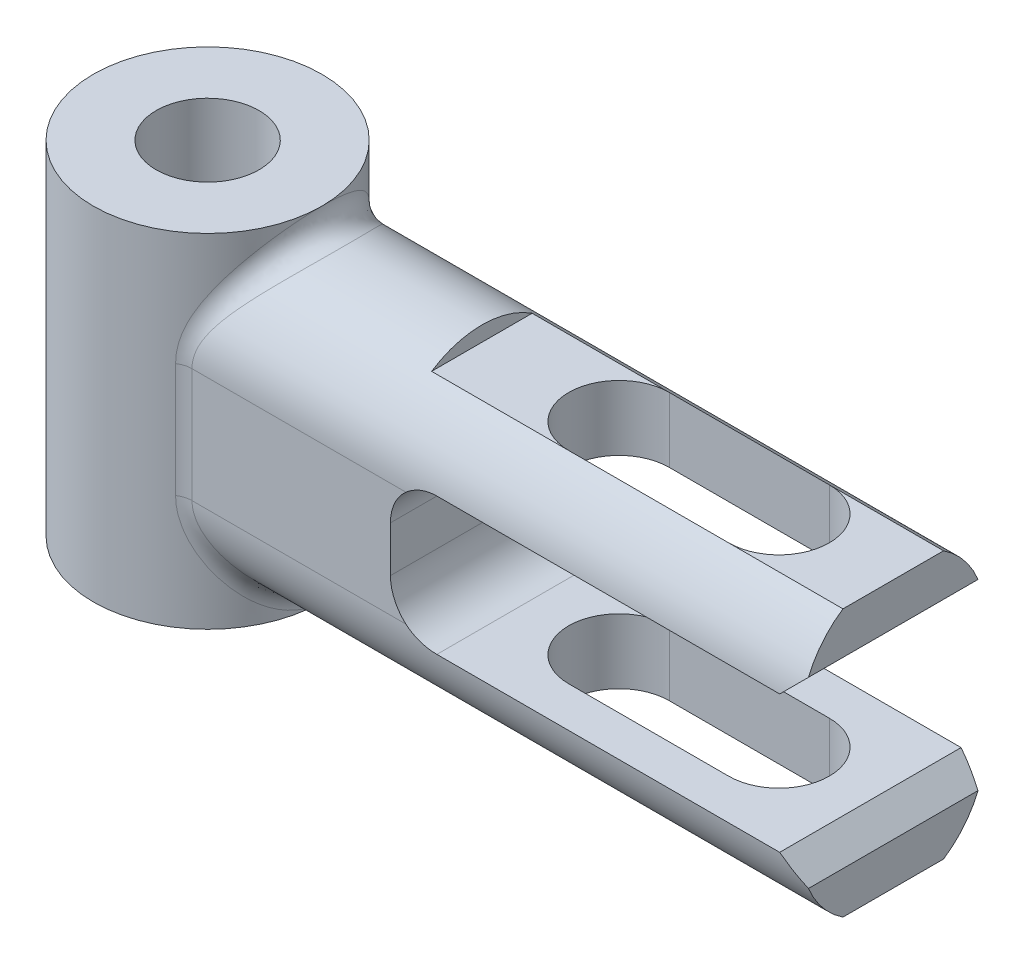
from build123d import *

# Parameters (mm, degrees)
SKETCH2_R            = 5
BOSS_EXTRUDE1_DEPTH  = 15
BOSS_EXTRUDE2_DEPTH  = 30
CUT_EXTRUDE1_DEPTH   = 34.911650063
M4_CLEARANCE_HOLE1_D = 4.5
FILLET1_R            = 1
SKETCH8_W            = 18
SKETCH8_H            = 6
SKETCH8_H_2          = 0.659341382
CUT_EXTRUDE2_DEPTH   = 35.727510864
CHAMFER1_SIZE        = 1
FILLET2_R            = 2


with BuildPart() as part:
    # Sketch2 → Boss-Extrude1 (new body)
    with BuildSketch(Plane(origin=(0, 0, 0), x_dir=(1, 0, 0), z_dir=(0, 1, 0))):
        with Locations(Location((0, 0, 0), (0, 0, 270))):
            Circle(SKETCH2_R)
    extrude(amount=BOSS_EXTRUDE1_DEPTH)

    # Sketch3 → Boss-Extrude2 (add)
    with BuildSketch(Plane(origin=(0, 0, 0), x_dir=(0, 0, -1), z_dir=(1, 0, 0))):
        with BuildLine():
            Line((-4, 5), (-4, 10))
            ThreePointArc((-4, 10), (0, 14), (4, 10))
            Line((4, 10), (4, 5))
            ThreePointArc((4, 5), (0, 1), (-4, 5))
        make_face()
    extrude(amount=BOSS_EXTRUDE2_DEPTH)

    # Sketch5 → Cut-Extrude1 (cut, through all)
    with BuildSketch(Plane(origin=(0, 0, 0), x_dir=(1, 0, 0), z_dir=(0, 1, 0))):
        with BuildLine():
            Line((18, 2.2), (25, 2.2))
            ThreePointArc((25, 2.2), (27.2, 0), (25, -2.2))
            Line((25, -2.2), (18, -2.2))
            ThreePointArc((18, -2.2), (15.8, 0), (18, 2.2))
        make_face()
    extrude(amount=CUT_EXTRUDE1_DEPTH, mode=Mode.SUBTRACT)

    # M4 Clearance Hole1 (through all)
    with Locations(Plane(origin=(0, 15, 0), x_dir=(1, 0, 0), z_dir=(0, 1, 0))):
        with Locations((0, 0)):
            Hole(M4_CLEARANCE_HOLE1_D / 2)

    # Fillet1
    fillet1_edges = [part.edges().sort_by_distance(p)[0] for p in [
        (3, 7.5, 4),
        (16.5, 5, 4),
        (3, 7.5, -4),
        (5, 1, 0),
    ]]
    fillet(fillet1_edges, radius=FILLET1_R)

    # Sketch8 → Cut-Extrude2 (cut, through all)
    with BuildSketch(Plane.XY.offset(4)):
        with Locations((21, 7.5)):
            Rectangle(SKETCH8_W, SKETCH8_H)
        with Locations((21, 1.329670691)):
            Rectangle(SKETCH8_W, SKETCH8_H_2)
        with Locations((21, 13.670329309)):
            Rectangle(SKETCH8_W, SKETCH8_H_2)
    extrude(amount=-CUT_EXTRUDE2_DEPTH, mode=Mode.SUBTRACT)

    # Chamfer1
    chamfer1_edges = [part.edges().sort_by_distance(p)[0] for p in [
        (30, 10.5, 0),
        (30, 4.5, 0),
    ]]
    chamfer(chamfer1_edges, length=CHAMFER1_SIZE)

    # Fillet2
    fillet2_edges = [part.edges().sort_by_distance(p)[0] for p in [
        (12, 10.5, 0),
        (12, 4.5, 0),
    ]]
    fillet(fillet2_edges, radius=FILLET2_R)


solid = part.part
